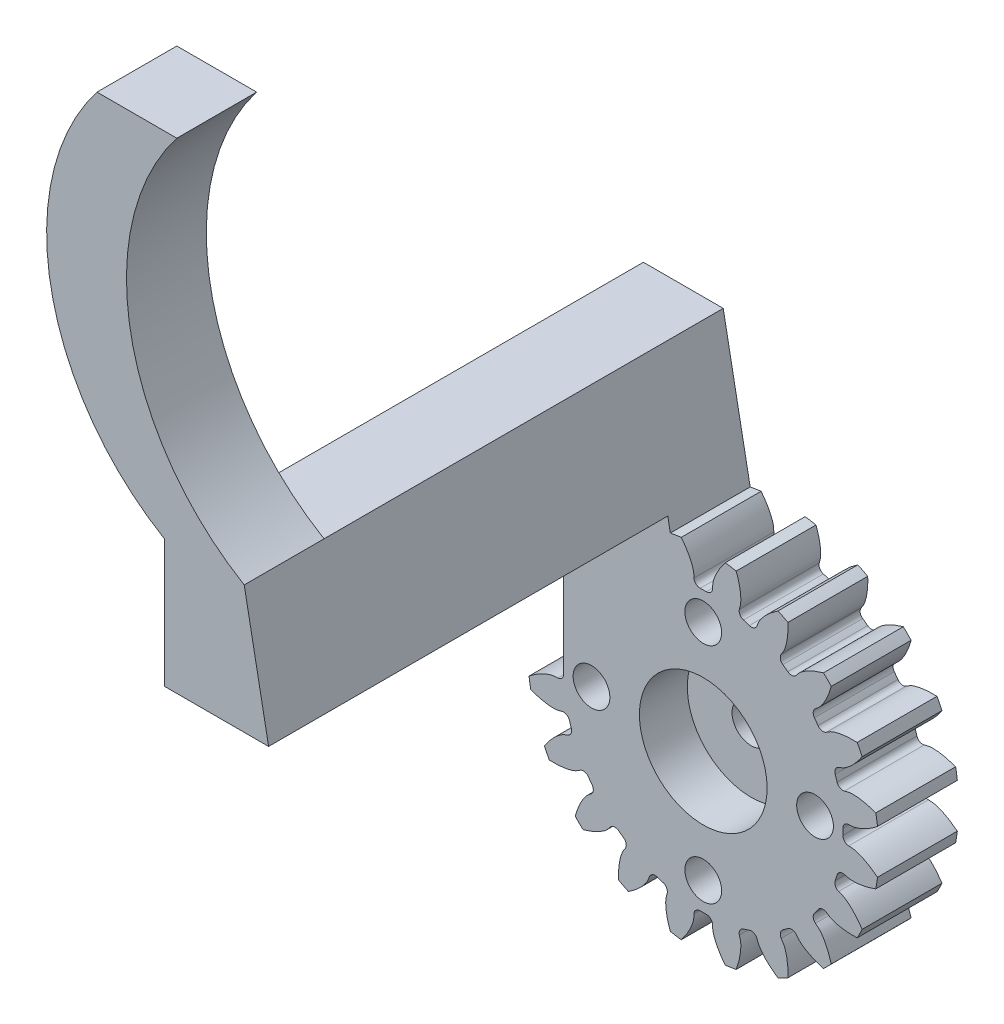
from build123d import *

# Parameters (mm, degrees)
SKETCH_1_R          = 11
LASHENA_DEPTH       = 5
CUT_EXTRUDEA_DEPTH  = 30
WWW_KYTOOL_CN_COUNT = 20
CUT_EXTRUDE_START   = -10
CUT_EXTRUDE_1_DEPTH = 10
EXTRUDE_START       = -5
EXTRUDE_1_DEPTH     = 5
EXTRUDE_2_DEPTH     = 25
EXTRUDE_4_DEPTH     = 5
SKETCH_7_R          = 1.15
CUT_EXTRUDE_2_DEPTH = 5
CUT_EXTRUDE_START_2 = -2
SKETCH_8_R          = 4
CUT_EXTRUDE_3_DEPTH = 3
SKETCH_10_R         = 1.2
CUT_EXTRUDE_5_DEPTH = 3


with BuildPart() as part:
    # 草图1 → LaShenA (new body)
    with BuildSketch(Plane.XY):
        Circle(SKETCH_1_R)
    extrude(amount=LASHENA_DEPTH)

    # SketchA → Cut-ExtrudeA (cut)
    with BuildSketch(Plane.XY.offset(5)):
        with BuildLine():
            ThreePointArc((0.192666948, 8.747878568), (0, 8.75), (-0.192666948, 8.747878568))
            ThreePointArc((-0.192666948, 8.747878568), (-0.458280641, 8.848100421), (-0.58031545, 9.104425526))
            add(Edge.make_bspline(
                [(-0.58031545, 9.104425526), (-0.585965039, 9.196150672), (-0.588120625, 9.316290214), (-0.608029006, 9.448424481), (-0.620371848, 9.504258495), (-0.631259446, 9.548464019), (-0.645249714, 9.599097693), (-0.662644566, 9.656034313), (-0.68381525, 9.719115424), (-0.709102663, 9.788174084), (-0.738848954, 9.863027121), (-0.773386802, 9.943477892), (-0.813042089, 10.029315748), (-0.858132409, 10.120316542), (-0.908966875, 10.216242847), (-0.965845542, 10.316844278), (-1.029058956, 10.421857806), (-1.098887686, 10.531008098), (-1.175601869, 10.644007865), (-1.259460763, 10.760558232), (-1.350712351, 10.880349119), (-1.449592793, 11.003059648), (-1.594932378, 11.173679385), (-1.711600622, 11.299586697), (-1.79314737, 11.383098021)],
                knots=[0.125068197, 0.125068197, 0.125068197, 0.125068197, 0.215847125, 0.244833276, 0.257593391, 0.272673526, 0.290073681, 0.309793857, 0.331834054, 0.356194271, 0.382874509, 0.411874767, 0.443195046, 0.476835345, 0.512795666, 0.551076006, 0.591676368, 0.634596749, 0.679837152, 0.727397575, 0.777278019, 0.829478483, 0.883998968, 1, 1, 1, 1], degree=3))
            ThreePointArc((-1.79314737, 11.383098021), (0, 11.523467275), (1.79314737, 11.383098021))
            add(Edge.make_bspline(
                [(0.58031545, 9.104425526), (0.585965039, 9.196150672), (0.588120625, 9.316290214), (0.608029006, 9.448424481), (0.620371848, 9.504258495), (0.631259446, 9.548464019), (0.645249714, 9.599097693), (0.662644566, 9.656034313), (0.68381525, 9.719115424), (0.709102663, 9.788174084), (0.738848954, 9.863027121), (0.773386802, 9.943477892), (0.813042089, 10.029315748), (0.858132409, 10.120316542), (0.908966875, 10.216242847), (0.965845542, 10.316844278), (1.029058956, 10.421857806), (1.098887686, 10.531008098), (1.175601869, 10.644007865), (1.259460763, 10.760558232), (1.350712351, 10.880349119), (1.449592793, 11.003059648), (1.594932378, 11.173679385), (1.711600622, 11.299586697), (1.79314737, 11.383098021)],
                knots=[0.125068197, 0.125068197, 0.125068197, 0.125068197, 0.215847125, 0.244833276, 0.257593391, 0.272673526, 0.290073681, 0.309793857, 0.331834054, 0.356194271, 0.382874509, 0.411874767, 0.443195046, 0.476835345, 0.512795666, 0.551076006, 0.591676368, 0.634596749, 0.679837152, 0.727397575, 0.777278019, 0.829478483, 0.883998968, 1, 1, 1, 1], degree=3))
            ThreePointArc((0.58031545, 9.104425526), (0.458280641, 8.848100421), (0.192666948, 8.747878568))
        make_face()
    cut_extrudea = extrude(amount=-CUT_EXTRUDEA_DEPTH, mode=Mode.SUBTRACT)

    # www.KYTool.cn: Cut-ExtrudeA ×20 about axis
    www_kytool_cn_axis = Axis((0, 0, -88.99), (0, 0, 1))
    for i in range(1, WWW_KYTOOL_CN_COUNT):
        add(cut_extrudea.rotate(www_kytool_cn_axis, i * 360 / WWW_KYTOOL_CN_COUNT), mode=Mode.SUBTRACT)

    # 草图2 → 切除-拉伸1 (cut)
    with BuildSketch(Plane(origin=(0, 0, 0), x_dir=(-1, 0, 0), z_dir=(0, 0, -1)).offset(CUT_EXTRUDE_START)):
        with BuildLine():
            ThreePointArc((-8.75, 0), (-7.135096447, 5.06486907), (-2.886480299, 8.260189555))
            Line((-2.886480299, 8.260189555), (-4.387662145, 13.55413461))
            Line((-4.387662145, 13.55413461), (-15.884017222, 0))
            Line((-15.884017222, 0), (-8.75, 0))
        make_face()
    extrude(amount=CUT_EXTRUDE_1_DEPTH, mode=Mode.SUBTRACT)

    # 草图3 → 凸台-拉伸1 (add)
    with BuildSketch(Plane(origin=(0, 0, 0), x_dir=(-1, 0, 0), z_dir=(0, 0, -1)).offset(EXTRUDE_START)):
        with BuildLine():
            add(Edge.make_bspline(
                [(-2.062154073, 10.804976658), (-2.084999477, 10.743926157), (-2.122809188, 10.637376249), (-2.171115501, 10.486333995), (-2.209156176, 10.355158845), (-2.241837949, 10.229772484), (-2.269506514, 10.110364664), (-2.292513789, 9.997110543), (-2.31121738, 9.890170492), (-2.325980031, 9.789689918), (-2.337169094, 9.695799109), (-2.345155884, 9.608613097), (-2.350315427, 9.528231519), (-2.353024887, 9.45473859), (-2.353666269, 9.388202787), (-2.352615373, 9.328677538), (-2.350274243, 9.276198823), (-2.346968706, 9.230792418), (-2.341453787, 9.173876968), (-2.319556048, 9.042057784), (-2.284480972, 8.927132177), (-2.261509421, 8.83815056)],
                knots=[0.332889329, 0.332889329, 0.332889329, 0.332889329, 0.397670622, 0.445231045, 0.490471448, 0.53339183, 0.573992191, 0.612272532, 0.648232852, 0.681873151, 0.71319343, 0.742193688, 0.768873926, 0.793234143, 0.81527434, 0.834994516, 0.852394671, 0.867474806, 0.880234921, 0.909221073, 1, 1, 1, 1], degree=3))
            Line((-2.062154073, 10.804976658), (-3.75, 19.648707628))
            Line((-3.75, 19.648707628), (-8.75, 19.648707628))
            Line((-8.75, 19.648707628), (-8.75, 0))
            ThreePointArc((-8.75, 0), (-7.021842791, 5.220749354), (-2.520005986, 8.379264277))
            ThreePointArc((-2.520005986, 8.379264277), (-2.298362608, 8.556660069), (-2.261509421, 8.83815056))
        make_face()
    extrude(amount=EXTRUDE_1_DEPTH)

    # 草图4 → 凸台-拉伸2 (add)
    with BuildSketch(Plane.XY.offset(5)):
        Polygon((2.223182025, 11.648707628), (8.75, 11.648707628), (8.75, 19.648707628), (3.75, 19.648707628), align=None)
    extrude(amount=EXTRUDE_2_DEPTH)

    # 草图6 → 凸台-拉伸4 (add)
    with BuildSketch(Plane.XY.offset(30)):
        with BuildLine():
            Line((7.971416859, 41.767477134), (12.971416859, 41.767477134))
            ThreePointArc((12.971416859, 41.767477134), (15.859136772, 29.754131101), (8.75, 19.648707628))
            Line((8.75, 19.648707628), (3.75, 19.648707628))
            ThreePointArc((3.75, 19.648707628), (10.859136772, 29.754131101), (7.971416859, 41.767477134))
        make_face()
    extrude(amount=-EXTRUDE_4_DEPTH)

    # 草图7 → 切除-拉伸2 (cut)
    with BuildSketch(Plane(origin=(0, 0, 0), x_dir=(-1, 0, 0), z_dir=(0, 0, -1))):
        with Locations((0, 7)):
            Circle(SKETCH_7_R)
        with Locations((7, 0)):
            Circle(SKETCH_7_R)
        with Locations((0, -7)):
            Circle(SKETCH_7_R)
        with Locations((-7, 0)):
            Circle(SKETCH_7_R)
    extrude(amount=-CUT_EXTRUDE_2_DEPTH, mode=Mode.SUBTRACT)

    # 草图8 → 切除-拉伸3 (cut)
    with BuildSketch(Plane(origin=(0, 0, 0), x_dir=(-1, 0, 0), z_dir=(0, 0, -1)).offset(CUT_EXTRUDE_START_2)):
        Circle(SKETCH_8_R)
    extrude(amount=-CUT_EXTRUDE_3_DEPTH, mode=Mode.SUBTRACT)

    # 草图10 → 切除-拉伸5 (cut)
    with BuildSketch(Plane.XY.offset(2)):
        Circle(SKETCH_10_R)
    extrude(amount=-CUT_EXTRUDE_5_DEPTH, mode=Mode.SUBTRACT)


with BuildPart() as body_2:
    # 镜向2: mirrored copy
    add(part.part.mirror(Plane(origin=(-20, 0, 0), x_dir=(0, 0, 1), z_dir=(1, 0, 0))))


solid = body_2.part
